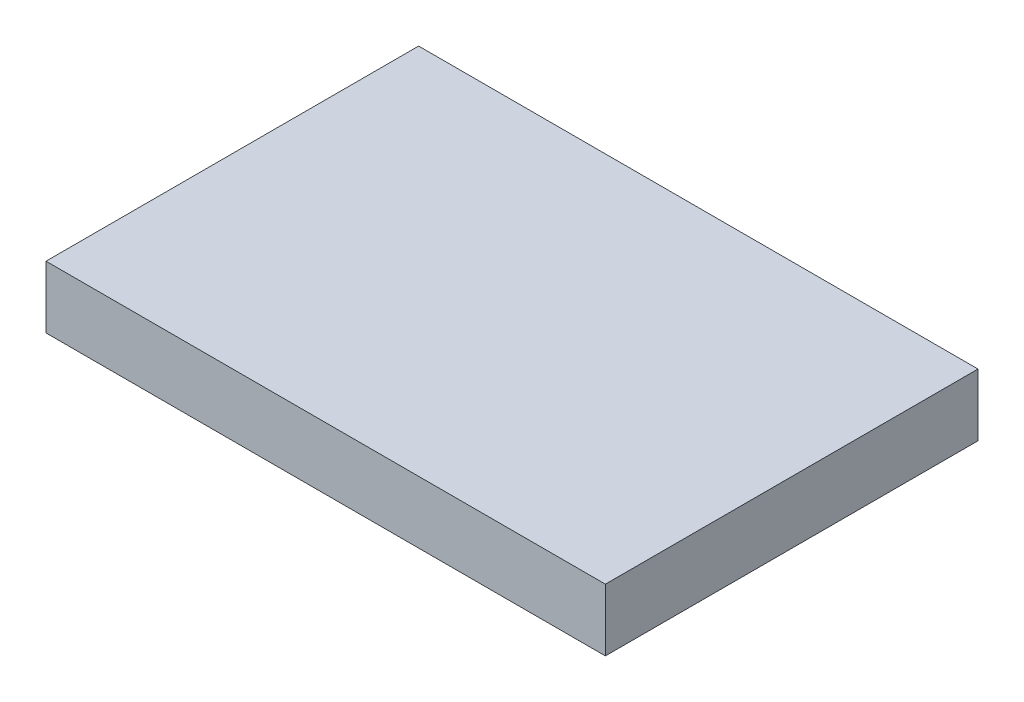
from build123d import *

# Parameters (mm, degrees)
SKETCH1_W           = 114.261019043
SKETCH1_H           = 76.109285411
BOSS_EXTRUDE1_DEPTH = 12.7


with BuildPart() as part:
    # Sketch1 → Boss-Extrude1 (new body)
    with BuildSketch(Plane(origin=(0, 0, 0), x_dir=(1, 0, 0), z_dir=(0, 1, 0))):
        with Locations((-57.130509522, 38.054642706)):
            Rectangle(SKETCH1_W, SKETCH1_H)
    extrude(amount=-BOSS_EXTRUDE1_DEPTH)


solid = part.part
